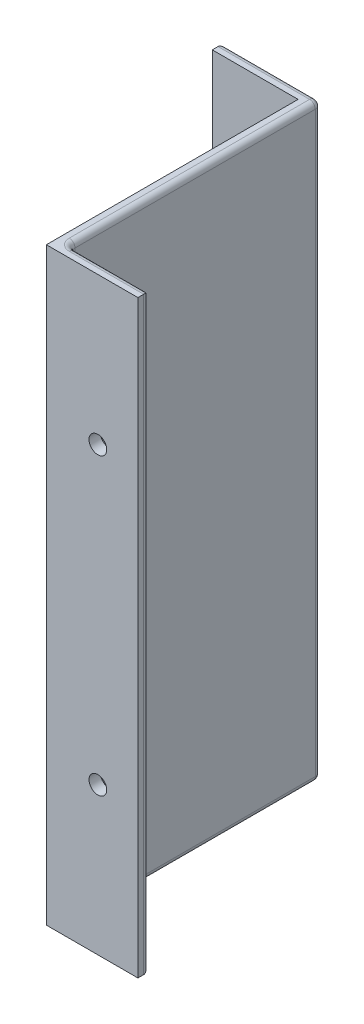
from build123d import *

# Parameters (mm, degrees)
RESSALTO_EXTRUS_O1_DEPTH = 103
ESBO_O2_R                = 1.55
CORTE_EXTRUS_O1_DEPTH    = 2
CORTE_EXTRUS_O2_DEPTH    = 0.5
FILETE1_R                = 1


with BuildPart() as part:
    # Esboço1 → Ressalto-extrusão1 (new body)
    with BuildSketch(Plane(origin=(0, 0, 0), x_dir=(1, 0, 0), z_dir=(0, 1, 0))):
        Polygon((0, 0), (16, 0), (16, 2), (2, 2), (2, 46), (-15, 46), (-15, 44), (0, 44), align=None)
    extrude(amount=RESSALTO_EXTRUS_O1_DEPTH)

    # Esboço2 → Corte-extrusão1 (cut)
    with BuildSketch(Plane(origin=(0, 0, -2), x_dir=(-1, 0, 0), z_dir=(0, 0, -1))):
        with Locations((-9, 77.25)):
            Circle(ESBO_O2_R)
        with Locations(Location((-9, 25.75, 0), (0, 0, 180))):
            Circle(ESBO_O2_R)
    extrude(amount=-CORTE_EXTRUS_O1_DEPTH, mode=Mode.SUBTRACT)

    # Esboço3 → Corte-extrusão2 (cut)
    # profile 1 of 8: a face of its own
    with BuildSketch(Plane(origin=(0, 0, -2), x_dir=(-1, 0, 0), z_dir=(0, 0, -1))):
        Polygon((-12.5, 60.721153846), (-12.5, 61.057692308), (-9.743890224, 62.223657853), (-12.5, 63.390324519), (-12.5, 63.727564103), (-9, 62.246794872), (-9, 62.201923077), align=None)
    # profile 2 of 8: a face of its own
    with BuildSketch(Plane(origin=(0, 0, -2), x_dir=(-1, 0, 0), z_dir=(0, 0, -1))):
        with BuildLine():
            Line((-11.423076923, 58.432692308), (-11.423076923, 58.118589744))
            add(Edge.make_bspline(
                [(-11.423076923, 58.118589744), (-11.464747811, 58.120636897), (-11.546588325, 58.124657451), (-11.665912232, 58.14348574), (-11.779967031, 58.170426617), (-11.887836945, 58.208518071), (-11.990475752, 58.255824349), (-12.087475767, 58.312554376), (-12.178466956, 58.379748227), (-12.262605799, 58.455954961), (-12.33979337, 58.5387236), (-12.406448613, 58.628029539), (-12.462766284, 58.721874567), (-12.509847526, 58.819973966), (-12.545187372, 58.923434529), (-12.571409012, 59.031317387), (-12.587185357, 59.144096523), (-12.588881143, 59.220936545), (-12.58974359, 59.260016026)],
                knots=[0, 0, 0, 0, 1.10065271, 2.161652631, 3.183658789, 4.190468796, 5.17591951, 6.163126047, 7.15150782, 8.156236427, 9.156009102, 10.134482811, 11.092018607, 12.041330605, 13.001268258, 13.972401359, 14.968799086, 16, 16, 16, 16], degree=3))
            add(Edge.make_bspline(
                [(-12.58974359, 59.260016026), (-12.588852424, 59.298396801), (-12.587101316, 59.373813652), (-12.571837144, 59.483837459), (-12.54844616, 59.588826559), (-12.513784407, 59.687591109), (-12.47029149, 59.781144713), (-12.416202348, 59.868329021), (-12.354076299, 59.951252241), (-12.280795578, 60.025844646), (-12.202604863, 60.094366768), (-12.119097837, 60.153428695), (-12.032749001, 60.204293291), (-11.942883845, 60.245924374), (-11.849209723, 60.277482586), (-11.752624723, 60.300864197), (-11.652014188, 60.314230389), (-11.583905673, 60.316270491), (-11.549278846, 60.317307692)],
                knots=[0, 0, 0, 0, 1.111674182, 2.184400057, 3.212814286, 4.223731311, 5.211378316, 6.196328225, 7.191884489, 8.207283132, 9.220262353, 10.201199469, 11.166417575, 12.120932471, 13.06540007, 14.026332106, 14.996573967, 16, 16, 16, 16], degree=3))
            add(Edge.make_bspline(
                [(-11.549278846, 60.317307692), (-11.500530165, 60.315615866), (-11.403888274, 60.312261902), (-11.261885815, 60.283526473), (-11.12424519, 60.238760085), (-11.013479624, 60.184415929), (-10.924023761, 60.130564808), (-10.8505287, 60.081718469), (-10.771712368, 60.024110035), (-10.686615211, 59.95820849), (-10.596722591, 59.882657453), (-10.499528359, 59.800472163), (-10.398131849, 59.707985246), (-10.328796454, 59.643361966), (-10.29286859, 59.609875801)],
                knots=[0, 0, 0, 0, 1.184287764, 2.347792955, 3.508658517, 4.695561027, 5.337795753, 6.047029248, 6.840419152, 7.71111932, 8.663527678, 9.695323177, 10.80577421, 12, 12, 12, 12], degree=3))
            Line((-10.29286859, 59.609875801), (-9.358974359, 58.734174679))
            Line((-9.358974359, 58.734174679), (-9.358974359, 60.362179487))
            Line((-9.358974359, 60.362179487), (-9, 60.362179487))
            Line((-9, 60.362179487), (-9, 57.983974359))
            Line((-9, 57.983974359), (-10.448517628, 59.341346154))
            add(Edge.make_bspline(
                [(-10.448517628, 59.341346154), (-10.483015935, 59.374394041), (-10.549280121, 59.437872268), (-10.646023081, 59.527654845), (-10.735772622, 59.608293833), (-10.818359171, 59.680311226), (-10.894990738, 59.742144731), (-10.963185442, 59.797016963), (-11.025939892, 59.840982554), (-11.098680506, 59.88869795), (-11.187492823, 59.934911931), (-11.296026513, 59.974624287), (-11.407753765, 59.998839136), (-11.483255802, 60.001743971), (-11.521233974, 60.003205128)],
                knots=[0, 0, 0, 0, 1.329631726, 2.553950428, 3.673215718, 4.687767853, 5.603093632, 6.413772471, 7.123043292, 7.734684054, 8.834405432, 9.900288307, 10.943827018, 12, 12, 12, 12], degree=3))
            add(Edge.make_bspline(
                [(-11.521233974, 60.003205128), (-11.545115373, 60.002569386), (-11.592181023, 60.00131646), (-11.661186782, 59.990258762), (-11.727751596, 59.973548256), (-11.792080215, 59.949602998), (-11.853525867, 59.917996258), (-11.912163347, 59.879522878), (-11.968852313, 59.835132815), (-12.022005611, 59.783781546), (-12.070686816, 59.727370026), (-12.113810902, 59.667775776), (-12.149850012, 59.604725672), (-12.179393509, 59.53848555), (-12.202568891, 59.46924008), (-12.21862747, 59.396855335), (-12.228709954, 59.321531319), (-12.230074126, 59.270097823), (-12.230769231, 59.243890224)],
                knots=[0, 0, 0, 0, 0.991446411, 1.95395049, 2.89581595, 3.838931463, 4.798493298, 5.75982156, 6.748411868, 7.785213223, 8.824556874, 9.840280684, 10.836137867, 11.835679398, 12.848801643, 13.863922112, 14.911575587, 16, 16, 16, 16], degree=3))
            add(Edge.make_bspline(
                [(-12.230769231, 59.243890224), (-12.230082413, 59.216512522), (-12.228733615, 59.162747234), (-12.218517149, 59.083975444), (-12.203028983, 59.008311704), (-12.178430394, 58.936884984), (-12.149365939, 58.868148585), (-12.11244268, 58.803569919), (-12.069537034, 58.742076784), (-12.019786187, 58.684680621), (-11.963887514, 58.632259658), (-11.902283318, 58.585553337), (-11.835417099, 58.545012256), (-11.76356329, 58.509591138), (-11.686006495, 58.480838784), (-11.603039645, 58.458864688), (-11.515018024, 58.441478106), (-11.454232973, 58.435669548), (-11.423076923, 58.432692308)],
                knots=[0, 0, 0, 0, 1.030878251, 2.024474673, 2.987898669, 3.934362936, 4.864849709, 5.795128259, 6.730474222, 7.685293701, 8.650606017, 9.611896181, 10.591709709, 11.591680886, 12.625074257, 13.701333388, 14.821793024, 16, 16, 16, 16], degree=3))
        make_face()
    # profile 3 of 8: a face of its own
    with BuildSketch(Plane(origin=(0, 0, -2), x_dir=(-1, 0, 0), z_dir=(0, 0, -1))):
        Polygon((-12.5, 56.035556891), (-12.5, 56.682692308), (-9, 56.682692308), (-9, 56.368589744), (-12.141025641, 56.368589744), (-12.141025641, 55.830128205), align=None)
    # profile 4 of 8: a face of its own
    with BuildSketch(Plane(origin=(0, 0, -2), x_dir=(-1, 0, 0), z_dir=(0, 0, -1))):
        Polygon((-12.5, 51.657051282), (-12.5, 53.631410256), (-12.141025641, 53.631410256), (-12.141025641, 51.971153846), (-11.064102564, 51.971153846), (-11.064102564, 53.631410256), (-10.705128205, 53.631410256), (-10.705128205, 51.971153846), (-9.358974359, 51.971153846), (-9.358974359, 53.631410256), (-9, 53.631410256), (-9, 51.657051282), align=None)
    # profile 5 of 8: a face of its own
    with BuildSketch(Plane(origin=(0, 0, -2), x_dir=(-1, 0, 0), z_dir=(0, 0, -1))):
        Polygon((-12.141025641, 49.189102564), (-12.5, 49.189102564), (-12.5, 51.028846154), (-12.141025641, 51.028846154), (-12.141025641, 50.266025641), (-9, 50.266025641), (-9, 49.951923077), (-12.141025641, 49.951923077), align=None)
    # profile 6 of 8: a face of its own
    with BuildSketch(Plane(origin=(0, 0, -2), x_dir=(-1, 0, 0), z_dir=(0, 0, -1))):
        Polygon((-9, 46.003205128), (-12.5, 46.003205128), (-12.5, 46.069110577), (-9.745292468, 48.381410256), (-12.5, 48.381410256), (-12.5, 48.695512821), (-9, 48.695512821), (-9, 48.623998397), (-11.748397436, 46.317307692), (-9, 46.317307692), align=None)
    # profile 7 of 8: a face of its own
    with BuildSketch(Plane(origin=(0, 0, -2), x_dir=(-1, 0, 0), z_dir=(0, 0, -1))):
        with BuildLine():
            add(Edge.make_bspline(
                [(-12.58974359, 43.423076923), (-12.588129744, 43.487892095), (-12.584960018, 43.61519444), (-12.559895231, 43.802115963), (-12.518641215, 43.981101701), (-12.460381735, 44.152254553), (-12.384855641, 44.314923583), (-12.293113066, 44.469568209), (-12.184596472, 44.615724978), (-12.060899323, 44.752387834), (-11.925430757, 44.877056019), (-11.780409088, 44.986452998), (-11.62765762, 45.078739675), (-11.467168388, 45.154286371), (-11.299316087, 45.213595534), (-11.123159994, 45.2545117), (-10.939853875, 45.280650636), (-10.814826932, 45.283706305), (-10.751402244, 45.28525641)],
                knots=[0, 0, 0, 0, 1.065064174, 2.09187391, 3.093564831, 4.079973196, 5.057907931, 6.036227367, 7.030399151, 8.044883615, 9.061699972, 10.052012555, 11.025713132, 11.989727027, 12.962874294, 13.945865945, 14.957962116, 16, 16, 16, 16], degree=3))
            add(Edge.make_bspline(
                [(-10.751402244, 45.28525641), (-10.688445124, 45.283705784), (-10.564349346, 45.280649319), (-10.382201223, 45.254490491), (-10.207127705, 45.213412964), (-10.039519009, 45.155020699), (-9.879355736, 45.079416032), (-9.726488631, 44.986993495), (-9.581079609, 44.877804139), (-9.444677774, 44.753665359), (-9.319901677, 44.617938723), (-9.2098443, 44.473474414), (-9.11751745, 44.320727019), (-9.041127343, 44.161279455), (-8.983054174, 43.993879686), (-8.94077499, 43.819745885), (-8.914895539, 43.637929312), (-8.911819755, 43.514074262), (-8.91025641, 43.451121795)],
                knots=[0, 0, 0, 0, 1.043748596, 2.057349401, 3.045489418, 4.02252776, 4.995289225, 5.97782527, 6.980224157, 8.006516136, 9.032559198, 10.034193337, 11.013412982, 11.987833483, 12.961212594, 13.946489799, 14.956251404, 16, 16, 16, 16], degree=3))
            add(Edge.make_bspline(
                [(-8.91025641, 43.451121795), (-8.911805797, 43.387697476), (-8.914860051, 43.26267126), (-8.941041456, 43.079134225), (-8.98198276, 42.902856481), (-9.040492196, 42.73434213), (-9.116109427, 42.5734972), (-9.208313806, 42.420007117), (-9.317720947, 42.27448797), (-9.441887521, 42.138146223), (-9.577059073, 42.013397025), (-9.721893329, 41.90463765), (-9.873548785, 41.812412536), (-10.032446309, 41.737049204), (-10.197817752, 41.677384744), (-10.370766229, 41.636679926), (-10.550305735, 41.610343974), (-10.672548634, 41.607309128), (-10.734575321, 41.605769231)],
                knots=[0, 0, 0, 0, 1.053102029, 2.075944431, 3.073151272, 4.055350789, 5.033113405, 6.020478099, 7.024410459, 8.052272461, 9.079885166, 10.07527673, 11.055994387, 12.023226415, 12.992069828, 13.970394897, 14.97016774, 16, 16, 16, 16], degree=3))
            add(Edge.make_bspline(
                [(-10.734575321, 41.605769231), (-10.77620799, 41.606303866), (-10.858948113, 41.607366393), (-10.981814713, 41.620158085), (-11.102705371, 41.638719786), (-11.221276319, 41.665321699), (-11.337237304, 41.700113366), (-11.451388067, 41.741165393), (-11.56257179, 41.791305239), (-11.671315182, 41.847985887), (-11.775923088, 41.911247695), (-11.874802671, 41.981123444), (-11.968783668, 42.055158813), (-12.055430672, 42.136322206), (-12.137264328, 42.221938651), (-12.213027045, 42.31339703), (-12.283401996, 42.410139274), (-12.346822337, 42.512581654), (-12.404181472, 42.618199929), (-12.453403323, 42.727076706), (-12.495649384, 42.837733278), (-12.529890209, 42.950687926), (-12.556922245, 43.065640698), (-12.575329599, 43.182842482), (-12.588153917, 43.302199909), (-12.589211419, 43.382611228), (-12.58974359, 43.423076923)],
                knots=[0, 0, 0, 0, 1.037015668, 2.060948919, 3.074880161, 4.083647147, 5.086022904, 6.090072063, 7.104153813, 8.122640571, 9.144368836, 10.147691507, 11.138137339, 12.123020368, 13.103399296, 14.087645067, 15.080126199, 16.082011238, 17.087798457, 18.072939717, 19.057185487, 20.037253025, 21.01195951, 21.997135196, 22.992090687, 24, 24, 24, 24], degree=3))
        make_face()
        with BuildLine():
            add(Edge.make_bspline(
                [(-12.230769231, 43.438501603), (-12.230365753, 43.405286544), (-12.229562654, 43.339173966), (-12.21892606, 43.24089571), (-12.203874783, 43.14388013), (-12.182015052, 43.048314965), (-12.153740439, 42.953999796), (-12.119639024, 42.860892752), (-12.078422353, 42.769313065), (-12.032069199, 42.679375145), (-11.979419431, 42.593156263), (-11.92351052, 42.510448779), (-11.862265147, 42.433403984), (-11.797007836, 42.3609635), (-11.727172255, 42.293307478), (-11.653217023, 42.23046576), (-11.574822262, 42.17248988), (-11.492310601, 42.120077551), (-11.40614272, 42.07343467), (-11.317965778, 42.031673343), (-11.226743513, 41.997054796), (-11.133045178, 41.969631749), (-11.037283681, 41.946355866), (-10.93893728, 41.93175551), (-10.838345009, 41.921014112), (-10.770362768, 41.920255499), (-10.735977564, 41.919871795)],
                knots=[0, 0, 0, 0, 1.008406545, 2.007172654, 2.999155034, 3.989332444, 4.982025741, 5.988181096, 6.998684226, 8.030553839, 9.059268815, 10.065399129, 11.060956322, 12.046057109, 13.024974577, 14.012068307, 14.991706172, 15.984221787, 16.978487447, 17.966117052, 18.945677757, 19.938371053, 20.93015022, 21.936155317, 22.956113857, 24, 24, 24, 24], degree=3))
            add(Edge.make_bspline(
                [(-10.735977564, 41.919871795), (-10.685416493, 41.921149574), (-10.585947224, 41.92366336), (-10.440162679, 41.945579314), (-10.299921154, 41.979605997), (-10.166058545, 42.02893826), (-10.037977921, 42.091871297), (-9.916177726, 42.168636824), (-9.80069389, 42.259937855), (-9.692386073, 42.363586807), (-9.593568594, 42.476924205), (-9.50670751, 42.59721416), (-9.433602799, 42.723504981), (-9.372488904, 42.855068762), (-9.326448237, 42.993028771), (-9.293621264, 43.136500462), (-9.272345169, 43.285487005), (-9.270278754, 43.3870127), (-9.269230769, 43.438501603)],
                knots=[0, 0, 0, 0, 1.032022337, 2.030307203, 3.003823408, 3.974715386, 4.937372378, 5.913284036, 6.909147208, 7.938749767, 8.970518239, 9.975863271, 10.963918693, 11.946286286, 12.933361397, 13.927862637, 14.949112547, 16, 16, 16, 16], degree=3))
            add(Edge.make_bspline(
                [(-9.269230769, 43.438501603), (-9.26970589, 43.47311124), (-9.270648197, 43.541752547), (-9.280152496, 43.643846073), (-9.295363267, 43.744109775), (-9.317371822, 43.8423584), (-9.344552167, 43.938720673), (-9.378266584, 44.032905837), (-9.418682089, 44.124882609), (-9.463723833, 44.215103258), (-9.514890039, 44.301547657), (-9.570045247, 44.383753456), (-9.630209968, 44.460665514), (-9.694590845, 44.53307201), (-9.764211752, 44.600253878), (-9.837717532, 44.662916673), (-9.916278677, 44.719890134), (-9.99845239, 44.772124784), (-10.083992054, 44.819336779), (-10.172411414, 44.859890148), (-10.263236245, 44.894523564), (-10.356533279, 44.922442021), (-10.452092652, 44.944330197), (-10.550051131, 44.95940938), (-10.650210365, 44.969958018), (-10.717954236, 44.970753068), (-10.752103365, 44.971153846)],
                knots=[0, 0, 0, 0, 1.047334373, 2.07717862, 3.100662057, 4.115010574, 5.122652213, 6.129548646, 7.140165612, 8.16200981, 9.179904151, 10.178566626, 11.156366481, 12.133321541, 13.108841334, 14.082538371, 15.054589433, 16.043660176, 17.028268541, 18.009491307, 18.985652105, 19.968123554, 20.954864208, 21.950389976, 22.966808393, 24, 24, 24, 24], degree=3))
            add(Edge.make_bspline(
                [(-10.752103365, 44.971153846), (-10.78601887, 44.970752733), (-10.85329652, 44.969957052), (-10.952757338, 44.959414577), (-11.05001055, 44.944313687), (-11.144674352, 44.922550978), (-11.236772879, 44.894500826), (-11.326219621, 44.859913492), (-11.413347837, 44.819128206), (-11.497942055, 44.772319928), (-11.579117087, 44.719704305), (-11.65671841, 44.662209319), (-11.729295218, 44.598846743), (-11.798614701, 44.531410349), (-11.863290324, 44.458278819), (-11.923072192, 44.379439389), (-11.980653876, 44.29685506), (-12.031614304, 44.208658248), (-12.0789118, 44.11796248), (-12.119263823, 44.024812838), (-12.153920496, 43.930539635), (-12.182099457, 43.834765951), (-12.20379105, 43.737537055), (-12.218939529, 43.63890949), (-12.229559, 43.539227521), (-12.23036454, 43.472183455), (-12.230769231, 43.438501603)],
                knots=[0, 0, 0, 0, 1.029877221, 2.042951179, 3.035109885, 4.018542222, 4.991021277, 5.957494829, 6.929429462, 7.911425532, 8.892163142, 9.866273635, 10.842761649, 11.81676864, 12.802607151, 13.805177466, 14.821356543, 15.858816981, 16.897175917, 17.927346774, 18.940346092, 19.946830556, 20.957962087, 21.964146003, 22.97721996, 24, 24, 24, 24], degree=3))
        make_face(mode=Mode.SUBTRACT)
    # profile 8 of 8: a face of its own
    with BuildSketch(Plane(origin=(0, 0, -2), x_dir=(-1, 0, 0), z_dir=(0, 0, -1))):
        Polygon((-12.5, 39.451923077), (-12.5, 41.157051282), (-12.141025641, 41.157051282), (-12.141025641, 39.766025641), (-11.064102564, 39.766025641), (-11.064102564, 41.157051282), (-10.705128205, 41.157051282), (-10.705128205, 39.766025641), (-9, 39.766025641), (-9, 39.451923077), align=None)
    extrude(amount=-CORTE_EXTRUS_O2_DEPTH, mode=Mode.SUBTRACT)

    # Filete1
    filete1_edges = [part.edges().sort_by_distance(p)[0] for p in [
        (9, 0, -2),
        (-15, 51.5, -46),
        (2, 51.5, -46),
        (2, 51.5, -2),
        (16, 51.5, -2),
        (9, 103, -2),
        (2, 103, -24),
        (-6.5, 103, -46),
        (-6.5, 0, -46),
        (2, 0, -24),
    ]]
    fillet(filete1_edges, radius=FILETE1_R)


solid = part.part
